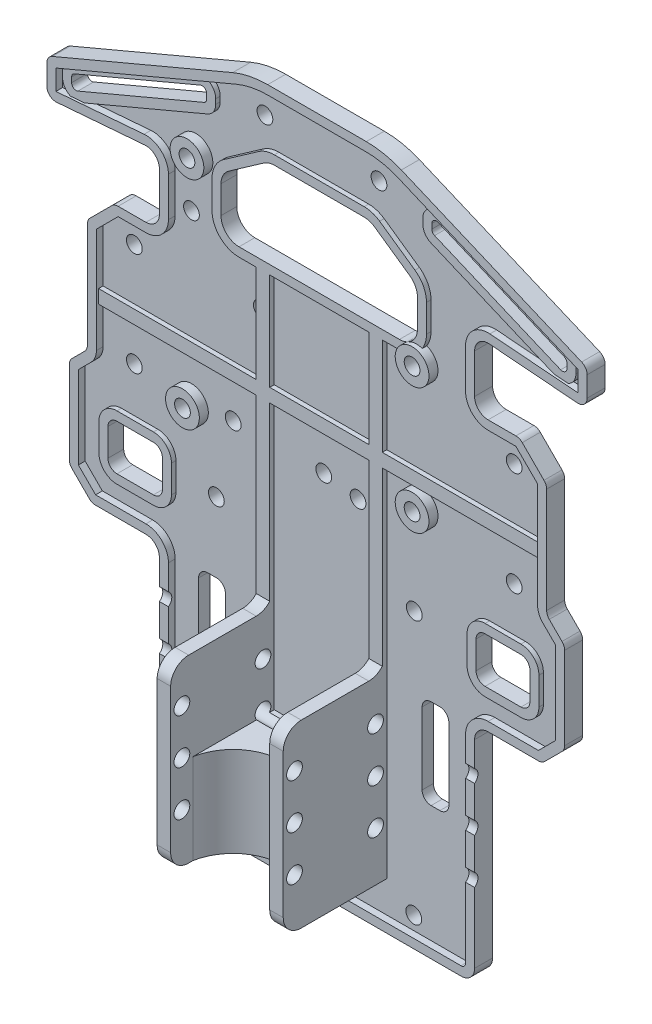
from build123d import *

# Parameters (mm, degrees)
BOSS_EXTRUDE1_DEPTH     = 2.5
CUT_EXTRUDE6_DEPTH      = 101.031245119
CUT_EXTRUDE8_DEPTH      = 101.031245119
CUT_EXTRUDE8_DEPTH_BACK = 101.031245119
SKETCH17_R              = 1.75
BOSS_EXTRUDE2_DEPTH     = 1.5
SKETCH20_R              = 1.75
CUT_EXTRUDE9_DEPTH      = 101.031245119
BOSS_EXTRUDE3_DEPTH     = 23
CUT_EXTRUDE10_DEPTH     = 33
SKETCH23_R              = 1.75
CUT_EXTRUDE11_DEPTH     = 112.920730877
LPATTERN1_COUNT         = 3
LPATTERN1_PITCH         = 10
FILLET1_R               = 4
BOSS_EXTRUDE4_START     = 1
BOSS_EXTRUDE4_DEPTH     = 1
BOSS_EXTRUDE5_START     = 2
SKETCH25_R              = 3.75
SKETCH25_R_2            = 1.75
BOSS_EXTRUDE5_DEPTH     = 2
BOSS_EXTRUDE6_DEPTH     = 1


with BuildPart() as part:
    # Sketch1 → Boss-Extrude1 (new body)
    with BuildSketch(Plane.XY):
        with BuildLine():
            Line((-35, 41.750415311), (-35, 33))
            ThreePointArc((-35, 33), (-35.878679656, 30.878679656), (-38, 30))
            Line((-38, 30), (-44.171572875, 30))
            ThreePointArc((-44.171572875, 30), (-44.93693974, 29.847759065), (-45.585786438, 29.414213562))
            Line((-45.585786438, 29.414213562), (-50.414213562, 24.585786438))
            ThreePointArc((-50.414213562, 24.585786438), (-50.847759065, 23.93693974), (-51, 23.171572875))
            Line((-51, 23.171572875), (-51, -0.171572875))
            ThreePointArc((-51, -0.171572875), (-51.152240935, -0.93693974), (-51.585786438, -1.585786438))
            Line((-51.585786438, -1.585786438), (-54.414213562, -4.414213562))
            ThreePointArc((-54.414213562, -4.414213562), (-54.847759065, -5.06306026), (-55, -5.828427125))
            Line((-55, -5.828427125), (-55, -24.171572875))
            ThreePointArc((-55, -24.171572875), (-54.847759065, -24.93693974), (-54.414213562, -25.585786438))
            Line((-54.414213562, -25.585786438), (-50.585786438, -29.414213562))
            ThreePointArc((-50.585786438, -29.414213562), (-49.93693974, -29.847759065), (-49.171572875, -30))
            Line((-49.171572875, -30), (-38, -30))
            ThreePointArc((-38, -30), (-35.878679656, -30.878679656), (-35, -33))
            Line((-35, -33), (-35, -77))
            ThreePointArc((-35, -77), (-34.121320344, -79.121320344), (-32, -80))
            Line((-32, -80), (32, -80))
            ThreePointArc((32, -80), (34.121320344, -79.121320344), (35, -77))
            Line((35, -77), (35, -33))
            ThreePointArc((35, -33), (35.878679656, -30.878679656), (38, -30))
            Line((38, -30), (49.171572875, -30))
            ThreePointArc((49.171572875, -30), (49.93693974, -29.847759065), (50.585786438, -29.414213562))
            Line((50.585786438, -29.414213562), (54.414213562, -25.585786438))
            ThreePointArc((54.414213562, -25.585786438), (54.847759065, -24.93693974), (55, -24.171572875))
            Line((55, -24.171572875), (55, -5.828427125))
            ThreePointArc((55, -5.828427125), (54.847759065, -5.06306026), (54.414213562, -4.414213562))
            Line((54.414213562, -4.414213562), (51.585786438, -1.585786438))
            ThreePointArc((51.585786438, -1.585786438), (51.152240935, -0.93693974), (51, -0.171572875))
            Line((51, -0.171572875), (51, 23.171572875))
            ThreePointArc((51, 23.171572875), (50.847759065, 23.93693974), (50.414213562, 24.585786438))
            Line((50.414213562, 24.585786438), (45.585786438, 29.414213562))
            ThreePointArc((45.585786438, 29.414213562), (44.93693974, 29.847759065), (44.171572875, 30))
            Line((44.171572875, 30), (38, 30))
            ThreePointArc((38, 30), (35.878679656, 30.878679656), (35, 33))
            Line((35, 33), (35, 41.750415311))
            ThreePointArc((35, 41.750415311), (35.965019288, 43.954696033), (38.239235667, 44.740861147))
            Line((38.239235667, 44.740861147), (57.840509555, 43.172759236))
            ThreePointArc((57.840509555, 43.172759236), (59.356653808, 43.696869311), (60, 45.166389793))
            Line((60, 45.166389793), (60, 49.673480046))
            ThreePointArc((60, 49.673480046), (59.666716555, 50.77894643), (58.777944074, 51.515979169))
            Line((58.777944074, 51.515979169), (18.730283933, 68.424991228))
            ThreePointArc((18.730283933, 68.424991228), (14.91948121, 69.602293546), (10.950843192, 70))
            Line((10.950843192, 70), (-10.950843192, 70))
            ThreePointArc((-10.950843192, 70), (-14.91948121, 69.602293546), (-18.730283933, 68.424991228))
            Line((-18.730283933, 68.424991228), (-58.777944074, 51.515979169))
            ThreePointArc((-58.777944074, 51.515979169), (-59.666716555, 50.77894643), (-60, 49.673480046))
            Line((-60, 49.673480046), (-60, 45.166389793))
            ThreePointArc((-60, 45.166389793), (-59.356653808, 43.696869311), (-57.840509555, 43.172759236))
            Line((-57.840509555, 43.172759236), (-38.239235667, 44.740861147))
            ThreePointArc((-38.239235667, 44.740861147), (-35.965019288, 43.954696033), (-35, 41.750415311))
        make_face()
    extrude(amount=BOSS_EXTRUDE1_DEPTH)

    # Sketch14 → Cut-Extrude6 (cut, through all)
    with BuildSketch(Plane.XY.offset(2.5)):
        with BuildLine():
            Line((-53.611027963, 47.184672776), (-25.611027963, 59.006894998))
            ThreePointArc((-25.611027963, 59.006894998), (-25.166641723, 59.375411367), (-25, 59.928144559))
            Line((-25, 59.928144559), (-25, 61.013626758))
            ThreePointArc((-25, 61.013626758), (-25.447266808, 61.846985036), (-26.388972037, 61.93487632))
            Line((-26.388972037, 61.93487632), (-54.388972037, 50.112654098))
            ThreePointArc((-54.388972037, 50.112654098), (-54.833358277, 49.744137728), (-55, 49.191404536))
            Line((-55, 49.191404536), (-55, 48.105922337))
            ThreePointArc((-55, 48.105922337), (-54.552733192, 47.27256406), (-53.611027963, 47.184672776))
        make_face()
        with BuildLine():
            Line((55, 49.191404536), (55, 48.105922337))
            ThreePointArc((55, 48.105922337), (54.552733192, 47.27256406), (53.611027963, 47.184672776))
            Line((53.611027963, 47.184672776), (25.611027963, 59.006894998))
            ThreePointArc((25.611027963, 59.006894998), (25.166641723, 59.375411367), (25, 59.928144559))
            Line((25, 59.928144559), (25, 61.013626758))
            ThreePointArc((25, 61.013626758), (25.447266808, 61.846985036), (26.388972037, 61.93487632))
            Line((26.388972037, 61.93487632), (54.388972037, 50.112654098))
            ThreePointArc((54.388972037, 50.112654098), (54.833358277, 49.744137728), (55, 49.191404536))
        make_face()
    extrude(amount=-CUT_EXTRUDE6_DEPTH, mode=Mode.SUBTRACT)

    # Sketch17 → Cut-Extrude8 (cut, two sides: drawn at the far end of the back side and taken through both)
    with BuildSketch(Plane.XY.offset(2.5).offset(-CUT_EXTRUDE8_DEPTH_BACK)):
        with Locations((21.620159532, 32.389035853)):
            Circle(SKETCH17_R)
        with Locations((21.620159532, 4.389035853)):
            Circle(SKETCH17_R)
        with Locations((-29.379840468, -1.210964147)):
            Circle(SKETCH17_R)
        with Locations((-28.379840468, 47.389035853)):
            Circle(SKETCH17_R)
        with Locations((-29.379840468, 35.789035853)):
            Circle(SKETCH17_R)
        with Locations((7.620159532, -1.210964147)):
            Circle(SKETCH17_R)
    extrude(amount=CUT_EXTRUDE8_DEPTH + CUT_EXTRUDE8_DEPTH_BACK, mode=Mode.SUBTRACT)

    # Sketch19 → Boss-Extrude2 (add)
    with BuildSketch(Plane.XY.offset(2.5)):
        with BuildLine():
            Line((60, 45.166389793), (60, 49.673480046))
            ThreePointArc((60, 49.673480046), (59.666716555, 50.77894643), (58.777944074, 51.515979169))
            Line((58.777944074, 51.515979169), (18.730283933, 68.424991228))
            ThreePointArc((18.730283933, 68.424991228), (14.91948121, 69.602293546), (10.950843192, 70))
            Line((10.950843192, 70), (-10.950843192, 70))
            ThreePointArc((-10.950843192, 70), (-14.91948121, 69.602293546), (-18.730283933, 68.424991228))
            Line((-18.730283933, 68.424991228), (-58.777944074, 51.515979169))
            ThreePointArc((-58.777944074, 51.515979169), (-59.666716555, 50.77894643), (-60, 49.673480046))
            Line((-60, 49.673480046), (-60, 45.166389793))
            ThreePointArc((-60, 45.166389793), (-59.356653808, 43.696869311), (-57.840509555, 43.172759236))
            Line((-57.840509555, 43.172759236), (-38.239235667, 44.740861147))
            ThreePointArc((-38.239235667, 44.740861147), (-35.965019288, 43.954696033), (-35, 41.750415311))
            Line((-35, 41.750415311), (-35, 33))
            ThreePointArc((-35, 33), (-35.878679656, 30.878679656), (-38, 30))
            Line((-38, 30), (-44.171572875, 30))
            ThreePointArc((-44.171572875, 30), (-44.93693974, 29.847759065), (-45.585786438, 29.414213562))
            Line((-45.585786438, 29.414213562), (-50.414213562, 24.585786438))
            ThreePointArc((-50.414213562, 24.585786438), (-50.847759065, 23.93693974), (-51, 23.171572875))
            Line((-51, 23.171572875), (-51, -0.171572875))
            ThreePointArc((-51, -0.171572875), (-51.152240935, -0.93693974), (-51.585786438, -1.585786438))
            Line((-51.585786438, -1.585786438), (-54.414213562, -4.414213562))
            ThreePointArc((-54.414213562, -4.414213562), (-54.847759065, -5.06306026), (-55, -5.828427125))
            Line((-55, -5.828427125), (-55, -24.171572875))
            ThreePointArc((-55, -24.171572875), (-54.847759065, -24.93693974), (-54.414213562, -25.585786438))
            Line((-54.414213562, -25.585786438), (-50.585786438, -29.414213562))
            ThreePointArc((-50.585786438, -29.414213562), (-49.93693974, -29.847759065), (-49.171572875, -30))
            Line((-49.171572875, -30), (-38, -30))
            ThreePointArc((-38, -30), (-35.878679656, -30.878679656), (-35, -33))
            Line((-35, -33), (-35, -77))
            ThreePointArc((-35, -77), (-34.121320344, -79.121320344), (-32, -80))
            Line((-32, -80), (32, -80))
            ThreePointArc((32, -80), (34.121320344, -79.121320344), (35, -77))
            Line((35, -77), (35, -33))
            ThreePointArc((35, -33), (35.878679656, -30.878679656), (38, -30))
            Line((38, -30), (49.171572875, -30))
            ThreePointArc((49.171572875, -30), (49.93693974, -29.847759065), (50.585786438, -29.414213562))
            Line((50.585786438, -29.414213562), (54.414213562, -25.585786438))
            ThreePointArc((54.414213562, -25.585786438), (54.847759065, -24.93693974), (55, -24.171572875))
            Line((55, -24.171572875), (55, -5.828427125))
            ThreePointArc((55, -5.828427125), (54.847759065, -5.06306026), (54.414213562, -4.414213562))
            Line((54.414213562, -4.414213562), (51.585786438, -1.585786438))
            ThreePointArc((51.585786438, -1.585786438), (51.152240935, -0.93693974), (51, -0.171572875))
            Line((51, -0.171572875), (51, 23.171572875))
            ThreePointArc((51, 23.171572875), (50.847759065, 23.93693974), (50.414213562, 24.585786438))
            Line((50.414213562, 24.585786438), (45.585786438, 29.414213562))
            ThreePointArc((45.585786438, 29.414213562), (44.93693974, 29.847759065), (44.171572875, 30))
            Line((44.171572875, 30), (38, 30))
            ThreePointArc((38, 30), (35.878679656, 30.878679656), (35, 33))
            Line((35, 33), (35, 41.750415311))
            ThreePointArc((35, 41.750415311), (35.965019288, 43.954696033), (38.239235667, 44.740861147))
            Line((38.239235667, 44.740861147), (57.840509555, 43.172759236))
            ThreePointArc((57.840509555, 43.172759236), (59.356653808, 43.696869311), (60, 45.166389793))
        make_face()
        with BuildLine():
            Line((58, 45.166389793), (58, 49.673480046))
            Line((58, 49.673480046), (17.952339859, 66.582492105))
            ThreePointArc((17.952339859, 66.582492105), (14.522617409, 67.642064192), (10.950843192, 68))
            Line((10.950843192, 68), (-10.950843192, 68))
            ThreePointArc((-10.950843192, 68), (-14.522617409, 67.642064192), (-17.952339859, 66.582492105))
            Line((-17.952339859, 66.582492105), (-58, 49.673480046))
            Line((-58, 49.673480046), (-58, 45.166389793))
            Line((-58, 45.166389793), (-38.398726111, 46.734491704))
            ThreePointArc((-38.398726111, 46.734491704), (-34.608365479, 45.424216514), (-33, 41.750415311))
            Line((-33, 41.750415311), (-33, 33))
            ThreePointArc((-33, 33), (-34.464466094, 29.464466094), (-38, 28))
            Line((-38, 28), (-44.171572875, 28))
            Line((-44.171572875, 28), (-49, 23.171572875))
            Line((-49, 23.171572875), (-49, -0.171572875))
            ThreePointArc((-49, -0.171572875), (-49.30448187, -1.702306605), (-50.171572875, -3))
            Line((-50.171572875, -3), (-53, -5.828427125))
            Line((-53, -5.828427125), (-53, -24.171572875))
            Line((-53, -24.171572875), (-49.171572875, -28))
            Line((-49.171572875, -28), (-38, -28))
            ThreePointArc((-38, -28), (-34.464466094, -29.464466094), (-33, -33))
            Line((-33, -33), (-33, -77))
            ThreePointArc((-33, -77), (-32.707106781, -77.707106781), (-32, -78))
            Line((-32, -78), (32, -78))
            ThreePointArc((32, -78), (32.707106781, -77.707106781), (33, -77))
            Line((33, -77), (33, -33))
            ThreePointArc((33, -33), (34.464466094, -29.464466094), (38, -28))
            Line((38, -28), (49.171572875, -28))
            Line((49.171572875, -28), (53, -24.171572875))
            Line((53, -24.171572875), (53, -5.828427125))
            Line((53, -5.828427125), (50.171572875, -3))
            ThreePointArc((50.171572875, -3), (49.30448187, -1.702306605), (49, -0.171572875))
            Line((49, -0.171572875), (49, 23.171572875))
            Line((49, 23.171572875), (44.171572875, 28))
            Line((44.171572875, 28), (38, 28))
            ThreePointArc((38, 28), (34.464466094, 29.464466094), (33, 33))
            Line((33, 33), (33, 41.750415311))
            ThreePointArc((33, 41.750415311), (34.608365479, 45.424216514), (38.398726111, 46.734491704))
            Line((38.398726111, 46.734491704), (58, 45.166389793))
        make_face(mode=Mode.SUBTRACT)
    extrude(amount=BOSS_EXTRUDE2_DEPTH)

    # Sketch20 → Cut-Extrude9 (cut, through all)
    with BuildSketch(Plane.XY.offset(2.5)):
        with Locations((-42.063788719, 22.958679518)):
            Circle(SKETCH20_R)
        with Locations((42.297587904, 22.958679518)):
            Circle(SKETCH20_R)
        with Locations((42.297587904, -0.128383611)):
            Circle(SKETCH20_R)
        with Locations((-42.063788719, 0)):
            Circle(SKETCH20_R)
        with Locations((-23.845073149, -16.476520205)):
            Circle(SKETCH20_R)
        with Locations((20.10871853, -16.476520205)):
            Circle(SKETCH20_R)
        with Locations((-20.10871853, 0)):
            Circle(SKETCH20_R)
        with Locations((-13.860133221, 24.581013684)):
            Circle(SKETCH20_R)
        with Locations((-13.060600457, 62.35325386)):
            Circle(SKETCH20_R)
        with Locations((12.268263331, 62.35325386)):
            Circle(SKETCH20_R)
        Circle(SKETCH20_R)
        with Locations((-25, -75)):
            Circle(SKETCH20_R)
        with Locations((-10, -75)):
            Circle(SKETCH20_R)
        with Locations((5, -75)):
            Circle(SKETCH20_R)
        with Locations((20, -75)):
            Circle(SKETCH20_R)
        with BuildLine():
            Line((-20.10871853, 48.534341211), (-12.268263331, 54.019136509))
            ThreePointArc((-12.268263331, 54.019136509), (-11.177384694, 54.556649905), (-9.975402579, 54.741517011))
            Line((-9.975402579, 54.741517011), (9.975402579, 54.741517011))
            ThreePointArc((9.975402579, 54.741517011), (11.177384694, 54.556649905), (12.268263331, 54.019136509))
            Line((12.268263331, 54.019136509), (20.10871853, 48.534341211))
            ThreePointArc((20.10871853, 48.534341211), (21.363493822, 47.104498349), (21.815857777, 45.256721714))
            Line((21.815857777, 45.256721714), (21.815857777, 39.127215003))
            ThreePointArc((21.815857777, 39.127215003), (20.644284902, 36.298787879), (17.815857777, 35.127215003))
            Line((17.815857777, 35.127215003), (-17.815857777, 35.127215003))
            ThreePointArc((-17.815857777, 35.127215003), (-20.644284902, 36.298787879), (-21.815857777, 39.127215003))
            Line((-21.815857777, 39.127215003), (-21.815857777, 45.256721714))
            ThreePointArc((-21.815857777, 45.256721714), (-21.363493822, 47.104498349), (-20.10871853, 48.534341211))
        make_face()
        with BuildLine():
            Line((23.845073149, -32.047731886), (25.785548208, -32.047731886))
            ThreePointArc((25.785548208, -32.047731886), (27.199761771, -32.633518324), (27.785548208, -34.047731886))
            Line((27.785548208, -34.047731886), (27.785548208, -50.012136511))
            ThreePointArc((27.785548208, -50.012136511), (27.199761771, -51.426350074), (25.785548208, -52.012136511))
            Line((25.785548208, -52.012136511), (23.845073149, -52.012136511))
            ThreePointArc((23.845073149, -52.012136511), (22.430859586, -51.426350074), (21.845073149, -50.012136511))
            Line((21.845073149, -50.012136511), (21.845073149, -34.047731886))
            ThreePointArc((21.845073149, -34.047731886), (22.430859586, -32.633518324), (23.845073149, -32.047731886))
        make_face()
        with BuildLine():
            Line((-25.794328973, -32.047731886), (-23.845073149, -32.047731886))
            ThreePointArc((-23.845073149, -32.047731886), (-22.430859586, -32.633518324), (-21.845073149, -34.047731886))
            Line((-21.845073149, -34.047731886), (-21.845073149, -50.012136511))
            ThreePointArc((-21.845073149, -50.012136511), (-22.430859586, -51.426350074), (-23.845073149, -52.012136511))
            Line((-23.845073149, -52.012136511), (-25.794328973, -52.012136511))
            ThreePointArc((-25.794328973, -52.012136511), (-27.208542535, -51.426350074), (-27.794328973, -50.012136511))
            Line((-27.794328973, -50.012136511), (-27.794328973, -34.047731886))
            ThreePointArc((-27.794328973, -34.047731886), (-27.208542535, -32.633518324), (-25.794328973, -32.047731886))
        make_face()
        with BuildLine():
            Line((44.790205594, -11.983902515), (36.825682441, -11.983902515))
            ThreePointArc((36.825682441, -11.983902515), (35.411468878, -12.569688952), (34.825682441, -13.983902515))
            Line((34.825682441, -13.983902515), (34.825682441, -20.092292317))
            ThreePointArc((34.825682441, -20.092292317), (35.411468878, -21.50650588), (36.825682441, -22.092292317))
            Line((36.825682441, -22.092292317), (44.790205594, -22.092292317))
            ThreePointArc((44.790205594, -22.092292317), (46.204419156, -21.50650588), (46.790205594, -20.092292317))
            Line((46.790205594, -20.092292317), (46.790205594, -13.983902515))
            ThreePointArc((46.790205594, -13.983902515), (46.204419156, -12.569688952), (44.790205594, -11.983902515))
        make_face()
        with BuildLine():
            Line((-36.825682441, -11.983902515), (-44.930791216, -11.983902515))
            ThreePointArc((-44.930791216, -11.983902515), (-46.345004779, -12.569688952), (-46.930791216, -13.983902515))
            Line((-46.930791216, -13.983902515), (-46.930791216, -20.092292317))
            ThreePointArc((-46.930791216, -20.092292317), (-46.345004779, -21.50650588), (-44.930791216, -22.092292317))
            Line((-44.930791216, -22.092292317), (-36.825682441, -22.092292317))
            ThreePointArc((-36.825682441, -22.092292317), (-35.411468878, -21.50650588), (-34.825682441, -20.092292317))
            Line((-34.825682441, -20.092292317), (-34.825682441, -13.983902515))
            ThreePointArc((-34.825682441, -13.983902515), (-35.411468878, -12.569688952), (-36.825682441, -11.983902515))
        make_face()
    extrude(amount=-CUT_EXTRUDE9_DEPTH, mode=Mode.SUBTRACT)

    # Sketch21 → Boss-Extrude3 (add)
    with BuildSketch(Plane.XY.offset(2.5)):
        Polygon((-14, -71), (-11, -71), (11, -71), (14, -71), (14, -31), (11, -31), (11, -51), (-11, -51), (-11, -31), (-14, -31), align=None)
    extrude(amount=BOSS_EXTRUDE3_DEPTH)

    # Sketch22 → Cut-Extrude10 (cut)
    with BuildSketch(Plane.XZ.offset(71)):
        with BuildLine():
            Line((-11, 20.5), (-11, 25.5))
            Line((-11, 25.5), (11, 25.5))
            Line((11, 25.5), (11, 20.5))
            ThreePointArc((11, 20.5), (0, 11.424273727), (-11, 20.5))
        make_face()
    extrude(amount=-CUT_EXTRUDE10_DEPTH, mode=Mode.SUBTRACT)

    # Sketch23 → Cut-Extrude11 (cut, symmetric)
    with BuildSketch(Plane.ZY.offset(14)):
        with Locations((5, -40)):
            Circle(SKETCH23_R)
        with Locations((23, -40)):
            Circle(SKETCH23_R)
    cut_extrude11 = extrude(amount=CUT_EXTRUDE11_DEPTH, both=True, mode=Mode.SUBTRACT)

    # LPattern1: Cut-Extrude11 ×3
    with Locations(*[(0, -i * LPATTERN1_PITCH, 0) for i in range(1, LPATTERN1_COUNT)]):
        add(cut_extrude11, mode=Mode.SUBTRACT)

    # Fillet1
    fillet1_edges = [part.edges().sort_by_distance(p)[0] for p in [
        (12.5, -31, 2.5),
        (-12.5, -31, 2.5),
        (-12.5, -71, 25.5),
        (12.5, -31, 25.5),
        (-12.5, -31, 25.5),
        (12.5, -71, 25.5),
    ]]
    fillet(fillet1_edges, radius=FILLET1_R)

    # Sketch24 → Boss-Extrude4 (add)
    # profile 1 of 5: a face of its own
    with BuildSketch(Plane.XY.offset(2.5).offset(BOSS_EXTRUDE4_START)):
        with BuildLine():
            Line((48.790205594, -20.092292317), (48.790205594, -13.983902515))
            ThreePointArc((48.790205594, -13.983902515), (47.618632719, -11.15547539), (44.790205594, -9.983902515))
            Line((44.790205594, -9.983902515), (36.825682441, -9.983902515))
            ThreePointArc((36.825682441, -9.983902515), (33.997255316, -11.15547539), (32.825682441, -13.983902515))
            Line((32.825682441, -13.983902515), (32.825682441, -20.092292317))
            ThreePointArc((32.825682441, -20.092292317), (33.997255316, -22.920719442), (36.825682441, -24.092292317))
            Line((36.825682441, -24.092292317), (44.790205594, -24.092292317))
            ThreePointArc((44.790205594, -24.092292317), (47.618632719, -22.920719442), (48.790205594, -20.092292317))
        make_face()
        with BuildLine():
            Line((46.790205594, -20.092292317), (46.790205594, -13.983902515))
            ThreePointArc((46.790205594, -13.983902515), (46.204419156, -12.569688952), (44.790205594, -11.983902515))
            Line((44.790205594, -11.983902515), (36.825682441, -11.983902515))
            ThreePointArc((36.825682441, -11.983902515), (35.411468878, -12.569688952), (34.825682441, -13.983902515))
            Line((34.825682441, -13.983902515), (34.825682441, -20.092292317))
            ThreePointArc((34.825682441, -20.092292317), (35.411468878, -21.50650588), (36.825682441, -22.092292317))
            Line((36.825682441, -22.092292317), (44.790205594, -22.092292317))
            ThreePointArc((44.790205594, -22.092292317), (46.204419156, -21.50650588), (46.790205594, -20.092292317))
        make_face(mode=Mode.SUBTRACT)
    # profile 2 of 5: a face of its own
    with BuildSketch(Plane.XY.offset(2.5).offset(BOSS_EXTRUDE4_START)):
        with BuildLine():
            Line((-17.815857777, 33.127215003), (17.815857777, 33.127215003))
            ThreePointArc((17.815857777, 33.127215003), (22.058498465, 34.884574316), (23.815857777, 39.127215003))
            Line((23.815857777, 39.127215003), (23.815857777, 45.256721714))
            ThreePointArc((23.815857777, 45.256721714), (23.137311844, 48.028386667), (21.255148906, 50.17315096))
            Line((21.255148906, 50.17315096), (13.414693708, 55.657946258))
            ThreePointArc((13.414693708, 55.657946258), (11.778375752, 56.464216352), (9.975402579, 56.741517011))
            Line((9.975402579, 56.741517011), (-9.975402579, 56.741517011))
            ThreePointArc((-9.975402579, 56.741517011), (-11.778375752, 56.464216352), (-13.414693708, 55.657946258))
            Line((-13.414693708, 55.657946258), (-21.255148906, 50.17315096))
            ThreePointArc((-21.255148906, 50.17315096), (-23.137311844, 48.028386667), (-23.815857777, 45.256721714))
            Line((-23.815857777, 45.256721714), (-23.815857777, 39.127215003))
            ThreePointArc((-23.815857777, 39.127215003), (-22.058498465, 34.884574316), (-17.815857777, 33.127215003))
        make_face()
        with BuildLine():
            Line((-21.815857777, 45.256721714), (-21.815857777, 39.127215003))
            ThreePointArc((-21.815857777, 39.127215003), (-20.644284902, 36.298787879), (-17.815857777, 35.127215003))
            Line((-17.815857777, 35.127215003), (17.815857777, 35.127215003))
            ThreePointArc((17.815857777, 35.127215003), (20.644284902, 36.298787879), (21.815857777, 39.127215003))
            Line((21.815857777, 39.127215003), (21.815857777, 45.256721714))
            ThreePointArc((21.815857777, 45.256721714), (21.363493822, 47.104498349), (20.10871853, 48.534341211))
            Line((20.10871853, 48.534341211), (12.268263331, 54.019136509))
            ThreePointArc((12.268263331, 54.019136509), (11.177384694, 54.556649905), (9.975402579, 54.741517011))
            Line((9.975402579, 54.741517011), (-9.975402579, 54.741517011))
            ThreePointArc((-9.975402579, 54.741517011), (-11.177384694, 54.556649905), (-12.268263331, 54.019136509))
            Line((-12.268263331, 54.019136509), (-20.10871853, 48.534341211))
            ThreePointArc((-20.10871853, 48.534341211), (-21.363493822, 47.104498349), (-21.815857777, 45.256721714))
        make_face(mode=Mode.SUBTRACT)
    # profile 3 of 5: a face of its own
    with BuildSketch(Plane.XY.offset(2.5).offset(BOSS_EXTRUDE4_START)):
        with BuildLine():
            Line((-32.825682441, -20.092292317), (-32.825682441, -13.983902515))
            ThreePointArc((-32.825682441, -13.983902515), (-33.997255316, -11.15547539), (-36.825682441, -9.983902515))
            Line((-36.825682441, -9.983902515), (-44.930791216, -9.983902515))
            ThreePointArc((-44.930791216, -9.983902515), (-47.759218341, -11.15547539), (-48.930791216, -13.983902515))
            Line((-48.930791216, -13.983902515), (-48.930791216, -20.092292317))
            ThreePointArc((-48.930791216, -20.092292317), (-47.759218341, -22.920719442), (-44.930791216, -24.092292317))
            Line((-44.930791216, -24.092292317), (-36.825682441, -24.092292317))
            ThreePointArc((-36.825682441, -24.092292317), (-33.997255316, -22.920719442), (-32.825682441, -20.092292317))
        make_face()
        with BuildLine():
            Line((-34.825682441, -20.092292317), (-34.825682441, -13.983902515))
            ThreePointArc((-34.825682441, -13.983902515), (-35.411468878, -12.569688952), (-36.825682441, -11.983902515))
            Line((-36.825682441, -11.983902515), (-44.930791216, -11.983902515))
            ThreePointArc((-44.930791216, -11.983902515), (-46.345004779, -12.569688952), (-46.930791216, -13.983902515))
            Line((-46.930791216, -13.983902515), (-46.930791216, -20.092292317))
            ThreePointArc((-46.930791216, -20.092292317), (-46.345004779, -21.50650588), (-44.930791216, -22.092292317))
            Line((-44.930791216, -22.092292317), (-36.825682441, -22.092292317))
            ThreePointArc((-36.825682441, -22.092292317), (-35.411468878, -21.50650588), (-34.825682441, -20.092292317))
        make_face(mode=Mode.SUBTRACT)
    # profile 4 of 5: a face of its own
    with BuildSketch(Plane.XY.offset(2.5).offset(BOSS_EXTRUDE4_START)):
        with BuildLine():
            Line((-23, 59.928144559), (-23, 61.013626758))
            ThreePointArc((-23, 61.013626758), (-24.341800424, 63.513701591), (-27.166916111, 63.777375443))
            Line((-27.166916111, 63.777375443), (-55.166916111, 51.95515322))
            ThreePointArc((-55.166916111, 51.95515322), (-56.500074832, 50.849604112), (-57, 49.191404536))
            Line((-57, 49.191404536), (-57, 48.105922337))
            ThreePointArc((-57, 48.105922337), (-55.658199576, 45.605847505), (-52.833083889, 45.342173653))
            Line((-52.833083889, 45.342173653), (-24.833083889, 57.164395875))
            ThreePointArc((-24.833083889, 57.164395875), (-23.499925168, 58.269944983), (-23, 59.928144559))
        make_face()
        with BuildLine():
            Line((-25, 59.928144559), (-25, 61.013626758))
            ThreePointArc((-25, 61.013626758), (-25.447266808, 61.846985036), (-26.388972037, 61.93487632))
            Line((-26.388972037, 61.93487632), (-54.388972037, 50.112654098))
            ThreePointArc((-54.388972037, 50.112654098), (-54.833358277, 49.744137728), (-55, 49.191404536))
            Line((-55, 49.191404536), (-55, 48.105922337))
            ThreePointArc((-55, 48.105922337), (-54.552733192, 47.27256406), (-53.611027963, 47.184672776))
            Line((-53.611027963, 47.184672776), (-25.611027963, 59.006894998))
            ThreePointArc((-25.611027963, 59.006894998), (-25.166641723, 59.375411367), (-25, 59.928144559))
        make_face(mode=Mode.SUBTRACT)
    # profile 5 of 5: a face of its own
    with BuildSketch(Plane.XY.offset(2.5).offset(BOSS_EXTRUDE4_START)):
        with BuildLine():
            Line((55.166916111, 51.95515322), (27.166916111, 63.777375443))
            ThreePointArc((27.166916111, 63.777375443), (24.341800424, 63.513701591), (23, 61.013626758))
            Line((23, 61.013626758), (23, 59.928144559))
            ThreePointArc((23, 59.928144559), (23.499925168, 58.269944983), (24.833083889, 57.164395875))
            Line((24.833083889, 57.164395875), (52.833083889, 45.342173653))
            ThreePointArc((52.833083889, 45.342173653), (55.658199576, 45.605847505), (57, 48.105922337))
            Line((57, 48.105922337), (57, 49.191404536))
            ThreePointArc((57, 49.191404536), (56.500074832, 50.849604112), (55.166916111, 51.95515322))
        make_face()
        with BuildLine():
            Line((54.388972037, 50.112654098), (26.388972037, 61.93487632))
            ThreePointArc((26.388972037, 61.93487632), (25.447266808, 61.846985036), (25, 61.013626758))
            Line((25, 61.013626758), (25, 59.928144559))
            ThreePointArc((25, 59.928144559), (25.166641723, 59.375411367), (25.611027963, 59.006894998))
            Line((25.611027963, 59.006894998), (53.611027963, 47.184672776))
            ThreePointArc((53.611027963, 47.184672776), (54.552733192, 47.27256406), (55, 48.105922337))
            Line((55, 48.105922337), (55, 49.191404536))
            ThreePointArc((55, 49.191404536), (54.833358277, 49.744137728), (54.388972037, 50.112654098))
        make_face(mode=Mode.SUBTRACT)
    extrude(amount=-BOSS_EXTRUDE4_DEPTH)

    # Sketch25 → Boss-Extrude5 (add)
    # profile 1 of 4: a face of its own
    with BuildSketch(Plane.XY.offset(2.5).offset(BOSS_EXTRUDE5_START)):
        with Locations(Location((21.620159532, 32.389035853, 0), (0, 0, 168.626051316))):
            Circle(SKETCH25_R)
        with Locations((21.620159532, 32.389035853)):
            Circle(SKETCH25_R_2, mode=Mode.SUBTRACT)
    # profile 2 of 4: a face of its own
    with BuildSketch(Plane.XY.offset(2.5).offset(BOSS_EXTRUDE5_START)):
        with Locations(Location((-28.379840468, 47.389035853, 0), (0, 0, 180))):
            Circle(SKETCH25_R)
        with Locations((-28.379840468, 47.389035853)):
            Circle(SKETCH25_R_2, mode=Mode.SUBTRACT)
    # profile 3 of 4: a face of its own
    with BuildSketch(Plane.XY.offset(2.5).offset(BOSS_EXTRUDE5_START)):
        with Locations(Location((-29.379840468, -1.210964147, 0), (0, 0, 180))):
            Circle(SKETCH25_R)
        with Locations((-29.379840468, -1.210964147)):
            Circle(SKETCH25_R_2, mode=Mode.SUBTRACT)
    # profile 4 of 4: a face of its own
    with BuildSketch(Plane.XY.offset(2.5).offset(BOSS_EXTRUDE5_START)):
        with Locations(Location((21.620159532, 4.389035853, 0), (0, 0, 180))):
            Circle(SKETCH25_R)
        with Locations((21.620159532, 4.389035853)):
            Circle(SKETCH25_R_2, mode=Mode.SUBTRACT)
    extrude(amount=-BOSS_EXTRUDE5_DEPTH)

    # Sketch26 → Boss-Extrude6 (add)
    with BuildSketch(Plane.XY.offset(2.5)):
        Polygon((-14, -35), (-11, -35), (-11, 8.503404189), (11, 8.503404189), (11, -35), (14, -35), (14, 8.503404189), (49, 8.503404189), (49, 11.503404189), (14, 11.503404189), (14, 33.127215003), (11, 33.127215003), (11, 11.503404189), (-11, 11.503404189), (-11, 33.127215003), (-14, 33.127215003), (-14, 11.503404189), (-49, 11.503404189), (-49, 8.503404189), (-14, 8.503404189), align=None)
    extrude(amount=BOSS_EXTRUDE6_DEPTH)


solid = part.part
